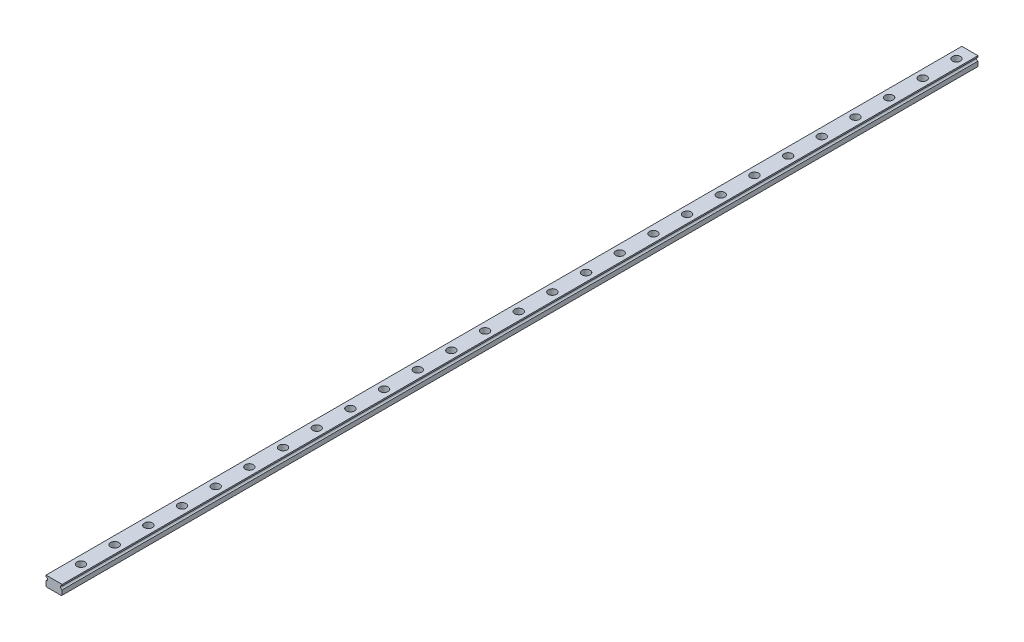
from build123d import *

# Parameters (mm, degrees)
EXTRUDE_1_DEPTH        = 680
PATTERN_LINEAR_1_COUNT = 15
PATTERN_LINEAR_1_PITCH = 25


with BuildPart() as part:
    # 草图1 → 凸台-拉伸1 (new body)
    with BuildSketch(Plane.XY):
        with BuildLine():
            Line((-6, 7.5), (-6, 6.5))
            ThreePointArc((-6, 6.5), (-4.75, 5.25), (-6, 4))
            Line((-6, 4), (-6, 0.5))
            Line((-6, 0.5), (-5.5, 0))
            Line((-5.5, 0), (5.5, 0))
            Line((5.5, 0), (6, 0.5))
            Line((6, 0.5), (6, 4))
            ThreePointArc((6, 4), (4.75, 5.25), (6, 6.5))
            Line((6, 6.5), (6, 7.5))
            Line((6, 7.5), (-6, 7.5))
        make_face()
    extrude(amount=EXTRUDE_1_DEPTH)

    # 草图2 → 切除-旋转1 (revolve, cut)
    with BuildSketch(Plane(origin=(0, 0, 0), x_dir=(0, 0, -1), z_dir=(1, 0, 0))):
        Polygon((-10, 7.5), (-7, 7.5), (-7, 3), (-8.25, 3), (-8.25, 0), (-10, 0), align=None)
    revolve(axis=Axis((0, 0, 10), (0, 1, 0)), mode=Mode.SUBTRACT)

    # 草图3 → 切除-旋转2 (revolve, cut)
    with BuildSketch(Plane(origin=(0, 0, 0), x_dir=(0, 0, -1), z_dir=(1, 0, 0))):
        Polygon((-310, 7.5), (-307, 7.5), (-307, 3), (-308.25, 3), (-308.25, 0), (-310, 0), align=None)
    cut_revolve_2 = revolve(axis=Axis((0, 0, 310), (0, 1, 0)), mode=Mode.SUBTRACT)

    # 草图4 → 切除-旋转3 (revolve, cut)
    with BuildSketch(Plane(origin=(0, 0, 0), x_dir=(0, 0, -1), z_dir=(1, 0, 0))):
        Polygon((-285, 7.5), (-282, 7.5), (-282, 3), (-283.25, 3), (-283.25, 0), (-285, 0), align=None)
    revolve(axis=Axis((0, 0, 285), (0, 1, 0)), mode=Mode.SUBTRACT)

    # 草图5 → 切除-旋转4 (revolve, cut)
    with BuildSketch(Plane(origin=(0, 0, 0), x_dir=(0, 0, -1), z_dir=(1, 0, 0))):
        Polygon((-260, 7.5), (-257, 7.5), (-257, 3), (-258.25, 3), (-258.25, 0), (-260, 0), align=None)
    revolve(axis=Axis((0, 0, 260), (0, 1, 0)), mode=Mode.SUBTRACT)

    # 草图6 → 切除-旋转5 (revolve, cut)
    with BuildSketch(Plane(origin=(0, 0, 0), x_dir=(0, 0, -1), z_dir=(1, 0, 0))):
        Polygon((-235, 7.5), (-232, 7.5), (-232, 3), (-233.25, 3), (-233.25, 0), (-235, 0), align=None)
    revolve(axis=Axis((0, 0, 235), (0, 1, 0)), mode=Mode.SUBTRACT)

    # 草图7 → 切除-旋转6 (revolve, cut)
    with BuildSketch(Plane(origin=(0, 0, 0), x_dir=(0, 0, -1), z_dir=(1, 0, 0))):
        Polygon((-210, 7.5), (-207, 7.5), (-207, 3), (-208.25, 3), (-208.25, 0), (-210, 0), align=None)
    revolve(axis=Axis((0, 0, 210), (0, 1, 0)), mode=Mode.SUBTRACT)

    # 草图8 → 切除-旋转7 (revolve, cut)
    with BuildSketch(Plane(origin=(0, 0, 0), x_dir=(0, 0, -1), z_dir=(1, 0, 0))):
        Polygon((-185, 7.5), (-182, 7.5), (-182, 3), (-183.25, 3), (-183.25, 0), (-185, 0), align=None)
    revolve(axis=Axis((0, 0, 185), (0, 1, 0)), mode=Mode.SUBTRACT)

    # 草图9 → 切除-旋转8 (revolve, cut)
    with BuildSketch(Plane(origin=(0, 0, 0), x_dir=(0, 0, -1), z_dir=(1, 0, 0))):
        Polygon((-160, 7.5), (-157, 7.5), (-157, 3), (-158.25, 3), (-158.25, 0), (-160, 0), align=None)
    revolve(axis=Axis((0, 0, 160), (0, 1, 0)), mode=Mode.SUBTRACT)

    # 草图10 → 切除-旋转9 (revolve, cut)
    with BuildSketch(Plane(origin=(0, 0, 0), x_dir=(0, 0, -1), z_dir=(1, 0, 0))):
        Polygon((-135, 7.5), (-132, 7.5), (-132, 3), (-133.25, 3), (-133.25, 0), (-135, 0), align=None)
    revolve(axis=Axis((0, 0, 135), (0, 1, 0)), mode=Mode.SUBTRACT)

    # 草图11 → 切除-旋转10 (revolve, cut)
    with BuildSketch(Plane(origin=(0, 0, 0), x_dir=(0, 0, -1), z_dir=(1, 0, 0))):
        Polygon((-110, 7.5), (-107, 7.5), (-107, 3), (-108.25, 3), (-108.25, 0), (-110, 0), align=None)
    revolve(axis=Axis((0, 0, 110), (0, 1, 0)), mode=Mode.SUBTRACT)

    # 草图12 → 切除-旋转11 (revolve, cut)
    with BuildSketch(Plane(origin=(0, 0, 0), x_dir=(0, 0, -1), z_dir=(1, 0, 0))):
        Polygon((-85, 7.5), (-82, 7.5), (-82, 3), (-83.25, 3), (-83.25, 0), (-85, 0), align=None)
    revolve(axis=Axis((0, 0, 85), (0, 1, 0)), mode=Mode.SUBTRACT)

    # 草图13 → 切除-旋转12 (revolve, cut)
    with BuildSketch(Plane(origin=(0, 0, 0), x_dir=(0, 0, -1), z_dir=(1, 0, 0))):
        Polygon((-60, 7.5), (-57, 7.5), (-57, 3), (-58.25, 3), (-58.25, 0), (-60, 0), align=None)
    revolve(axis=Axis((0, 0, 60), (0, 1, 0)), mode=Mode.SUBTRACT)

    # 草图14 → 切除-旋转13 (revolve, cut)
    with BuildSketch(Plane(origin=(0, 0, 0), x_dir=(0, 0, -1), z_dir=(1, 0, 0))):
        Polygon((-35, 7.5), (-32, 7.5), (-32, 3), (-33.25, 3), (-33.25, 0), (-35, 0), align=None)
    revolve(axis=Axis((0, 0, 35), (0, 1, 0)), mode=Mode.SUBTRACT)

    # 阵列(线性)1: 切除-旋转2 ×15
    with Locations(*[(0, 0, i * PATTERN_LINEAR_1_PITCH) for i in range(1, PATTERN_LINEAR_1_COUNT)]):
        add(cut_revolve_2, mode=Mode.SUBTRACT)


solid = part.part
